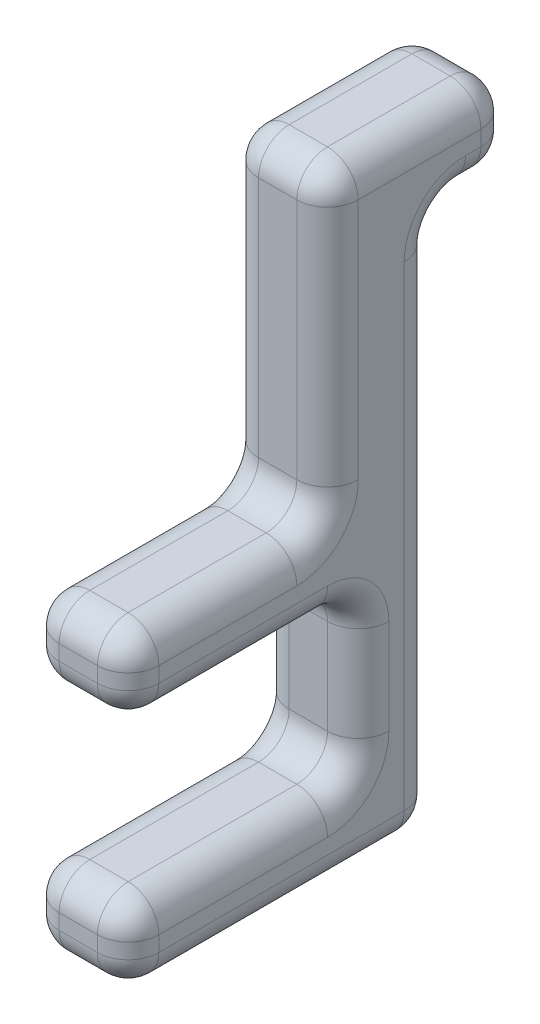
from build123d import *

# Parameters (mm, degrees)
SKETCH1_W           = 6.5
SKETCH1_H           = 40
BOSS_EXTRUDE1_DEPTH = 20
SKETCH2_W           = 15
SKETCH2_H           = 10.2
CUT_EXTRUDE1_DEPTH  = 46.191260217
FILLET1_R           = 2
SKETCH4_W           = 13
SKETCH4_H           = 19.8
CUT_EXTRUDE3_DEPTH  = 46.191260217
SKETCH6_W           = 6.5
SKETCH6_H           = 5
BOSS_EXTRUDE2_DEPTH = 5
FILLET2_R           = 2


with BuildPart() as part:
    # Sketch1 → Boss-Extrude1 (new body)
    with BuildSketch(Plane.XY):
        with Locations((-3.25, 20)):
            Rectangle(SKETCH1_W, SKETCH1_H)
    extrude(amount=BOSS_EXTRUDE1_DEPTH)

    # Sketch2 → Cut-Extrude1 (cut, through all)
    with BuildSketch(Plane(origin=(0, 0, 0), x_dir=(0, 0, -1), z_dir=(1, 0, 0))):
        with Locations((-12.5, 10.1)):
            Rectangle(SKETCH2_W, SKETCH2_H)
    extrude(amount=-CUT_EXTRUDE1_DEPTH, mode=Mode.SUBTRACT)

    # Fillet1
    fillet1_edges = [part.edges().sort_by_distance(p)[0] for p in [
        (-6.5, 15.2, 12.5),
        (-6.5, 10.1, 5),
        (-3.25, 15.2, 5),
        (-6.5, 5, 12.5),
        (-3.25, 5, 5),
        (0, 5, 12.5),
        (0, 10.1, 5),
        (0, 15.2, 12.5),
    ]]
    fillet(fillet1_edges, radius=FILLET1_R)

    # Sketch4 → Cut-Extrude3 (cut, through all)
    with BuildSketch(Plane.ZY.offset(6.5)):
        with Locations((13.5, 30.1)):
            Rectangle(SKETCH4_W, SKETCH4_H)
    extrude(amount=-CUT_EXTRUDE3_DEPTH, mode=Mode.SUBTRACT)

    # Sketch6 → Boss-Extrude2 (add)
    with BuildSketch(Plane(origin=(0, 0, 0), x_dir=(-1, 0, 0), z_dir=(0, 0, -1))):
        with Locations((3.25, 37.5)):
            Rectangle(SKETCH6_W, SKETCH6_H)
    extrude(amount=BOSS_EXTRUDE2_DEPTH)

    # Fillet2
    fillet2_edges = [part.edges().sort_by_distance(p)[0] for p in [
        (-3.25, 0, 20),
        (-6.5, 1.5, 20),
        (-3.25, 5, 20),
        (-0.585786438, 4.414213562, 20),
        (-5.914213562, 4.414213562, 20),
        (0, 18.7, 20),
        (-3.25, 15.2, 20),
        (-0.585786438, 15.785786438, 20),
        (-5.914213562, 15.785786438, 20),
        (0, 1.5, 20),
        (-3.25, 0, 0),
        (0, 17.5, 0),
        (-6.5, 18.7, 20),
        (-6.5, 40, 1),
        (0, 40, 1),
        (0, 20.2, 13.5),
        (-3.25, 20.2, 20),
        (0, 30.1, 7),
        (-3.25, 20.2, 7),
        (-3.25, 40, 7),
        (-6.5, 30.1, 7),
        (-6.5, 20.2, 13.5),
        (-6.5, 17.5, 0),
        (0, 0, 10),
        (-3.25, 35, 0),
        (-6.5, 0, 10),
        (0, 35, -2.5),
        (-6.5, 35, -2.5),
        (0, 37.5, -5),
        (-3.25, 35, -5),
        (-6.5, 37.5, -5),
        (-3.25, 40, -5),
    ]]
    fillet(fillet2_edges, radius=FILLET2_R)


solid = part.part
